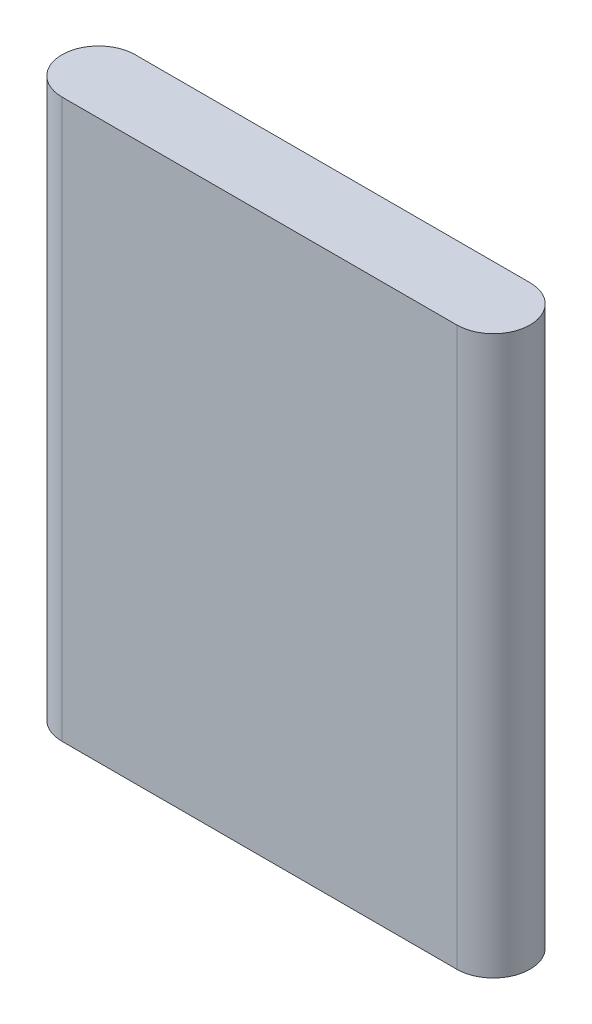
from build123d import *

# Parameters (mm, degrees)
SKETCH1_W           = 50.5
SKETCH1_H           = 60.2
BOSS_EXTRUDE1_DEPTH = 3.95
FILLET1_RADIUS      = 3.95
FILLET1_LENGTH      = 60.2
FILLET2_RADIUS      = 3.95
FILLET2_LENGTH      = 60.2


with BuildPart() as part:
    # Sketch1 → Boss-Extrude1 (new, symmetric)
    with BuildSketch(Plane.XY):
        Rectangle(SKETCH1_W, SKETCH1_H)
    extrude(amount=BOSS_EXTRUDE1_DEPTH, both=True)

    # Fillet1: full round fillet: the end face becomes a half cylinder, R = half its width
    fillet1_face = Plane((-25.25, 0, 0), x_dir=(0, 1, 0), z_dir=(-1, 0, 0))  # on the end face: x along it, z out of the body
    fillet1_slab = fillet1_face.offset(-FILLET1_RADIUS / 2) * Box(FILLET1_LENGTH, 2 * FILLET1_RADIUS, FILLET1_RADIUS, mode=Mode.PRIVATE)  # the body's end, R deep
    fillet1_round = Plane((-21.3, 0, 0), x_dir=(-1, 0, 0), z_dir=(0, 1, 0)) * Cylinder(FILLET1_RADIUS, FILLET1_LENGTH, mode=Mode.PRIVATE)  # its axis R under the face
    add(fillet1_slab - fillet1_round, mode=Mode.SUBTRACT)

    # Fillet2: full round fillet: the end face becomes a half cylinder, R = half its width
    fillet2_face = Plane((25.25, 0, 0), x_dir=(0, -1, 0), z_dir=(1, 0, 0))  # on the end face: x along it, z out of the body
    fillet2_slab = fillet2_face.offset(-FILLET2_RADIUS / 2) * Box(FILLET2_LENGTH, 2 * FILLET2_RADIUS, FILLET2_RADIUS, mode=Mode.PRIVATE)  # the body's end, R deep
    fillet2_round = Plane((21.3, 0, 0), x_dir=(1, 0, 0), z_dir=(0, -1, 0)) * Cylinder(FILLET2_RADIUS, FILLET2_LENGTH, mode=Mode.PRIVATE)  # its axis R under the face
    add(fillet2_slab - fillet2_round, mode=Mode.SUBTRACT)


solid = part.part
